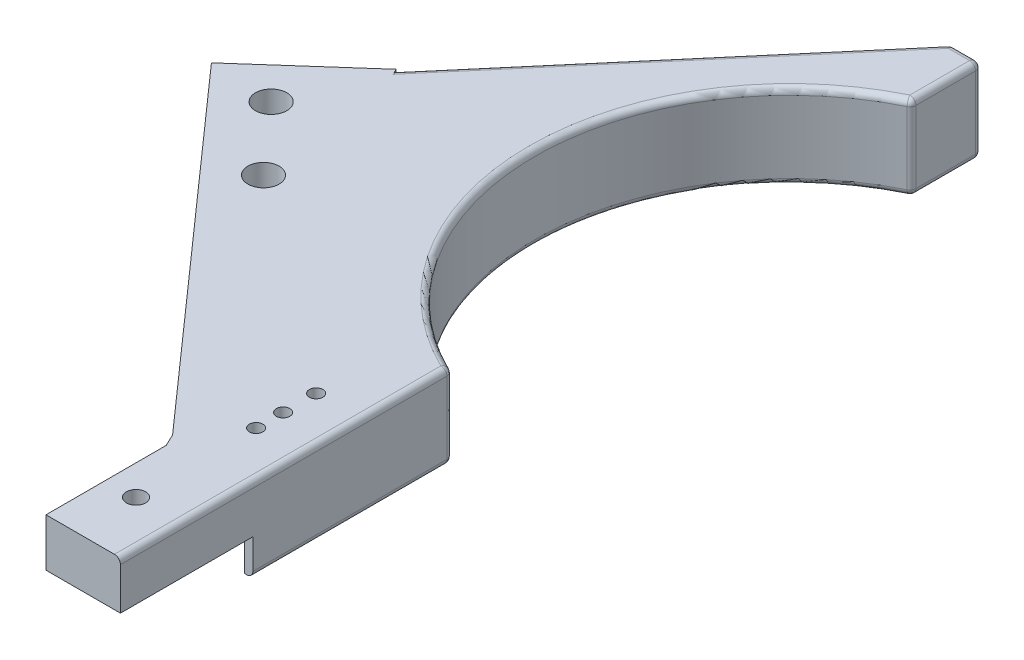
from build123d import *

# Parameters (mm, degrees)
BOSS_EXTRUDE1_DEPTH      = 14
SKETCH3_R                = 4.125
CUT_EXTRUDE1_DEPTH       = 6
SKETCH5_R                = 1.125
CUT_EXTRUDE2_DEPTH       = 15
FILLET1_R                = 1
BOSS_EXTRUDE3_DEPTH      = 20
BOSS_EXTRUDE3_DEPTH_BACK = 34
SKETCH7_W                = 46.707438453
SKETCH7_H                = 20
CUT_EXTRUDE3_DEPTH       = 30
BOSS_EXTRUDE4_DEPTH      = 3
BOSS_EXTRUDE5_START      = -54
BOSS_EXTRUDE5_DEPTH      = 3
CUT_EXTRUDE5_REACH       = 111.564
SKETCH15_W               = 26.880557743
SKETCH15_H               = 40.856784115
CUT_EXTRUDE6_REACH       = 113.249
SKETCH16_R               = 1.6
CUT_EXTRUDE7_DEPTH       = 112.248863996
CUT_EXTRUDE8_DEPTH       = 106.753443393
SKETCH20_R               = 2.6
CUT_EXTRUDE9_DEPTH       = 106.753443393


with BuildPart() as part:
    # Sketch1 → Boss-Extrude1 (new body)
    with BuildSketch(Plane(origin=(0, 0, 0), x_dir=(1, 0, 0), z_dir=(0, 1, 0))):
        with BuildLine():
            Line((47.5, -78.442713945), (47.5, -38.442713945))
            ThreePointArc((47.5, -38.442713945), (23.122023742, 0), (47.5, 38.442713945))
            Line((47.5, 38.442713945), (47.5, 50))
            Line((47.5, 50), (42.5, 50))
            Line((42.5, 50), (0, 0))
            Line((0, 0), (35.1, -73.422380253))
            Line((35.1, -73.422380253), (35.1, -93.442713945))
            Line((35.1, -93.442713945), (37.5, -93.442713945))
            Line((37.5, -93.442713945), (47.5, -93.442713945))
            Line((47.5, -93.442713945), (47.5, -78.442713945))
        make_face()
    extrude(amount=BOSS_EXTRUDE1_DEPTH)

    # Sketch3 → Cut-Extrude1 (cut)
    with BuildSketch(Plane.XZ):
        with BuildLine():
            Line((33.254958794, 84.403112572), (36.18509612, 92.428977457))
            Line((36.18509612, 92.428977457), (44.88509612, 92.428977457))
            Line((44.88509612, 92.428977457), (46.13509612, 88.028977457))
            Line((46.13509612, 88.028977457), (46.13509612, 70.028977457))
            Line((46.13509612, 70.028977457), (44.820911197, 53.062159312))
            ThreePointArc((44.820911197, 53.062159312), (40.059955227, 48.679043991), (35.34566343, 53.112310791))
            Line((35.34566343, 53.112310791), (33.254958794, 84.403112572))
        make_face()
        with Locations(Location((40.08509612, 83.428977457, 0), (0, 0, 90))):
            Circle(SKETCH3_R, mode=Mode.SUBTRACT)
    extrude(amount=-CUT_EXTRUDE1_DEPTH, mode=Mode.SUBTRACT)

    # Sketch5 → Cut-Extrude2 (cut)
    with BuildSketch(Plane.XZ.offset(-6)):
        with Locations(Location((40.08509612, 63.428977457, 0), (0, 0, 270))):
            Circle(SKETCH5_R)
        with Locations(Location((40.08509612, 58.928977457, 0), (0, 0, 270))):
            Circle(SKETCH5_R)
        with Locations(Location((40.08509612, 53.428977457, 0), (0, 0, 270))):
            Circle(SKETCH5_R)
    extrude(amount=-CUT_EXTRUDE2_DEPTH, mode=Mode.SUBTRACT)

    # Fillet1
    fillet1_edges = [part.edges().sort_by_distance(p)[0] for p in [
        (21.25, 0, -25),
        (45, 0, -50),
        (47.5, 0, -44.221356973),
        (23.122023742, 14, 0),
        (23.122023742, 0, 0),
        (47.5, 0, 65.942713945),
        (47.5, 14, -44.221356973),
        (42.5, 7, -50),
        (47.5, 7, -50),
        (47.5, 7, -38.442713945),
        (47.5, 7, 38.442713945),
        (45, 14, -50),
        (21.25, 14, -25),
        (47.5, 14, 65.942713945),
    ]]
    fillet(fillet1_edges, radius=FILLET1_R)

    # Sketch6 → Boss-Extrude3 (add, two sides: drawn at the far end of the back side and taken through both)
    with BuildSketch(Plane.XZ.offset(-BOSS_EXTRUDE3_DEPTH_BACK)):
        with BuildLine():
            Line((-40.458581161, -20.077158004), (-49.887563088, -23.407968691))
            Line((-49.887563088, -23.407968691), (34.124921356, 71.382705183))
            Line((34.124921356, 71.382705183), (0, 0))
            ThreePointArc((0, 0), (-10.212270894, 1.77453397), (-20.560220827, 2.374016932))
            Line((-20.560220827, 2.374016932), (-40.458581161, -20.077158004))
        make_face()
    extrude(amount=BOSS_EXTRUDE3_DEPTH + BOSS_EXTRUDE3_DEPTH_BACK)

    # Sketch7 → Cut-Extrude3 (cut)
    with BuildSketch(Plane(origin=(-16.32086192, 0, 14.465095586), x_dir=(0.6632786778078259, 0, 0.7483724978682089), z_dir=(-0.7483724978682089, 0, 0.6632786778078259))):
        with Locations((52.701466874, 24)):
            Rectangle(SKETCH7_W, SKETCH7_H)
        with Locations((52.701466874, -10)):
            Rectangle(SKETCH7_W, SKETCH7_H)
    extrude(amount=-CUT_EXTRUDE3_DEPTH, mode=Mode.SUBTRACT)

    # Sketch10 → Boss-Extrude4 (add)
    with BuildSketch(Plane.XZ.offset(20)):
        Polygon((-49.887563088, -23.407968691), (-42.403838109, -30.040755469), (0, 0), (-16.723629197, 14.010656202), align=None)
    extrude(amount=-BOSS_EXTRUDE4_DEPTH)

    # Sketch10<2> → Boss-Extrude5 (add)
    with BuildSketch(Plane.XZ.offset(20).offset(BOSS_EXTRUDE5_START)):
        Polygon((-49.887563088, -23.407968691), (-42.403838109, -30.040755469), (0, 0), (-16.723629197, 14.010656202), align=None)
    extrude(amount=BOSS_EXTRUDE5_DEPTH)

    # Cut-Extrude5: up to this face of the body (flat: up to its plane)
    cut_extrude5_end = Plane(part.part.faces().sort_by_distance((40.08509612, 0, 83.428977457))[0])
    # Sketch15 → Cut-Extrude5 (cut, up to the picked face)
    with BuildSketch(Plane(origin=(0, 6, 0), x_dir=(-1, 0, 0), z_dir=(0, -1, 0)), mode=Mode.PRIVATE) as cut_extrude5_sk1:
        with Locations((-44.420319758, -91.811097241)):
            Rectangle(SKETCH15_W, SKETCH15_H)
    cut_extrude5_tool1 = split(extrude(cut_extrude5_sk1.sketch, amount=CUT_EXTRUDE5_REACH, mode=Mode.PRIVATE), bisect_by=cut_extrude5_end, keep=Keep.BOTH, mode=Mode.PRIVATE)
    add(cut_extrude5_tool1.solids().sort_by(Axis((44.42032, 6, 91.811097), (0, -1, 0)))[0], mode=Mode.SUBTRACT)

    # Sketch16 → Cut-Extrude6 (cut, up to next)
    with BuildSketch(Plane(origin=(0, 14, 0), x_dir=(1, 0, 0), z_dir=(0, 1, 0)), mode=Mode.PRIVATE) as cut_extrude6_sk1:
        with Locations(Location((40.08509612, -83.428977457, 0), (0, 0, 270))):
            Circle(SKETCH16_R)
    cut_extrude6_tool1 = extrude(cut_extrude6_sk1.sketch, amount=-CUT_EXTRUDE6_REACH, mode=Mode.PRIVATE) & part.part
    add(cut_extrude6_tool1.solids().sort_by_distance((40.085096, 14, 83.428977))[0], mode=Mode.SUBTRACT)

    # Sketch18 → Cut-Extrude7 (cut, through all)
    with BuildSketch(Plane(origin=(0, 0, 0), x_dir=(-0.4313049702307203, 0, -0.902206197415135), z_dir=(0.902206197415135, 0, -0.4313049702307203))):
        Polygon((-39.631978176, 14), (0, 14), (0, 0), (-37.370332893, 0), (-34.306310934, -43.962437664), (76.533165387, -56.066116366), (76.533165387, 47.196171587), (-42.014855984, 38.664050635), align=None)
    extrude(amount=-CUT_EXTRUDE7_DEPTH, mode=Mode.SUBTRACT)

    # Sketch19 → Cut-Extrude8 (cut, through all)
    with BuildSketch(Plane(origin=(0, 0, 0), x_dir=(-1, 0, 0), z_dir=(0, -1, 0))):
        Polygon((16.32086192, -14.465095586), (0, 0), (18.115156321, 31.62995048), (35.203757787, 6.840338193), align=None)
    extrude(amount=-CUT_EXTRUDE8_DEPTH, mode=Mode.SUBTRACT)

    # Sketch20 → Cut-Extrude9 (cut, through all)
    with BuildSketch(Plane(origin=(0, 0, 0), x_dir=(-1, 0, 0), z_dir=(0, -1, 0))):
        with Locations(Location((5.733478103, -15.103299236, 0), (0, 0, 90))):
            Circle(SKETCH20_R)
        with Locations(Location((-4.215702064, -26.328886704, 0), (0, 0, 90))):
            Circle(SKETCH20_R)
    extrude(amount=-CUT_EXTRUDE9_DEPTH, mode=Mode.SUBTRACT)


solid = part.part
